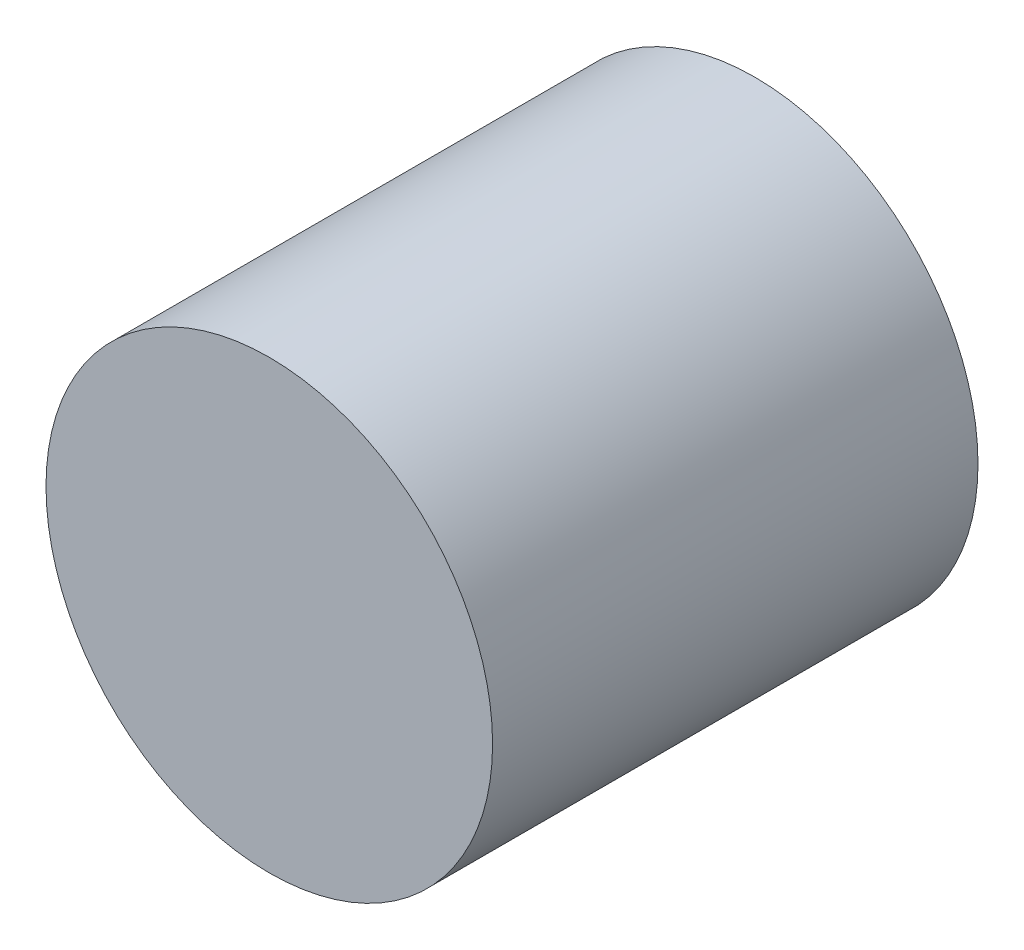
from build123d import *

# Parameters (mm, degrees)
SKETCH1_R           = 2.3
BOSS_EXTRUDE1_DEPTH = 5


with BuildPart() as part:
    # Sketch1 → Boss-Extrude1 (new body)
    with BuildSketch(Plane.XY):
        Circle(SKETCH1_R)
    extrude(amount=BOSS_EXTRUDE1_DEPTH)


solid = part.part
